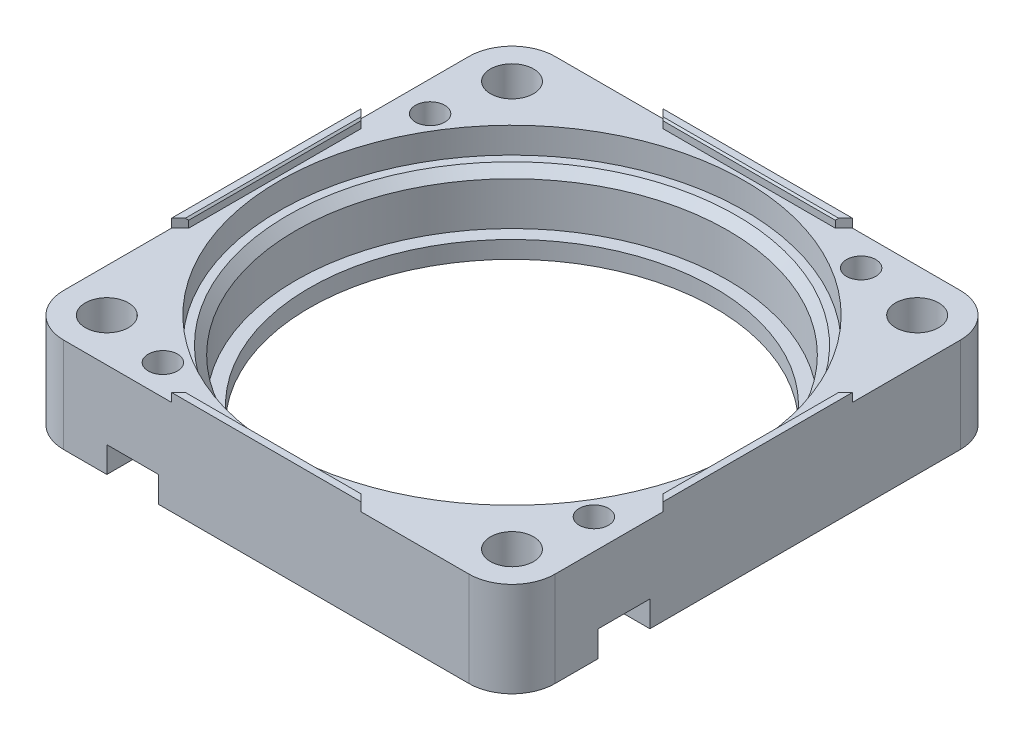
from build123d import *

# Parameters (mm, degrees)
SKETCH_1_W                           = 57
SKETCH_1_H                           = 57
EXTRUDE_1_DEPTH                      = 11
FILLET_1_R                           = 5
SKETCH_2_R                           = 27
CUT_EXTRUDE_1_DEPTH                  = 3
SKETCH_3_R                           = 25.05
CUT_EXTRUDE_2_DEPTH                  = 6
SKETCH_4_R                           = 23.5
CUT_EXTRUDE_3_DEPTH                  = 2
CHAMFER_1_SIZE                       = 1
SKETCH_5_R                           = 2.5
SKETCH_5_R_2                         = 1.7
CUT_EXTRUDE_4_DEPTH                  = 42.779181419
EXTRUDE_2_DEPTH                      = 1
CHAMFER_2_SIZE                       = 0.2
CUT_EXTRUDE_5_DEPTH                  = 3
PATTERN_CIRCULAR_1_COUNT             = 4
CHAMFER_2_OF_PATTERN_CIRCULAR_1_SIZE = 0.2


with BuildPart() as part:
    # 草图1 → 凸台-拉伸1 (new body)
    with BuildSketch(Plane(origin=(0, 0, 0), x_dir=(1, 0, 0), z_dir=(0, 1, 0))):
        Rectangle(SKETCH_1_W, SKETCH_1_H)
    extrude(amount=EXTRUDE_1_DEPTH)

    # 圆角1
    fillet_1_edges = [part.edges().sort_by_distance(p)[0] for p in [
        (28.5, 5.5, 28.5),
        (-28.5, 5.5, 28.5),
        (-28.5, 5.5, -28.5),
        (28.5, 5.5, -28.5),
    ]]
    fillet(fillet_1_edges, radius=FILLET_1_R)

    # 草图2 → 切除-拉伸1 (cut)
    with BuildSketch(Plane(origin=(0, 11, 0), x_dir=(1, 0, 0), z_dir=(0, 1, 0))):
        with Locations(Location((0, 0, 0), (0, 0, 270))):
            Circle(SKETCH_2_R)
    extrude(amount=-CUT_EXTRUDE_1_DEPTH, mode=Mode.SUBTRACT)

    # 草图3 → 切除-拉伸2 (cut)
    with BuildSketch(Plane(origin=(0, 8, 0), x_dir=(1, 0, 0), z_dir=(0, 1, 0))):
        with Locations(Location((0, 0, 0), (0, 0, 270))):
            Circle(SKETCH_3_R)
    extrude(amount=-CUT_EXTRUDE_2_DEPTH, mode=Mode.SUBTRACT)

    # 草图4 → 切除-拉伸3 (cut)
    with BuildSketch(Plane(origin=(0, 2, 0), x_dir=(1, 0, 0), z_dir=(0, 1, 0))):
        with Locations(Location((0, 0, 0), (0, 0, 270))):
            Circle(SKETCH_4_R)
    extrude(amount=-CUT_EXTRUDE_3_DEPTH, mode=Mode.SUBTRACT)

    # 倒角1
    chamfer_1_edges = [part.edges().sort_by_distance(p)[0] for p in [
        (0, 8, -25.05),
    ]]
    chamfer(chamfer_1_edges, length=CHAMFER_1_SIZE)

    # 草图5 → 切除-拉伸4 (cut, through all)
    with BuildSketch(Plane(origin=(0, 11, 0), x_dir=(1, 0, 0), z_dir=(0, 1, 0))):
        with Locations(Location((-23.5, 23.5, 0), (0, 0, 270))):
            Circle(SKETCH_5_R)
        with Locations(Location((-25, 15.5, 0), (0, 0, 270))):
            Circle(SKETCH_5_R_2)
    cut_extrude_4 = extrude(amount=-CUT_EXTRUDE_4_DEPTH, mode=Mode.SUBTRACT)

    # 草图6 → 凸台-拉伸2 (add)
    with BuildSketch(Plane(origin=(0, 11, 0), x_dir=(1, 0, 0), z_dir=(0, 1, 0))):
        Polygon((-28.5, 11), (-28.5, -11), (-27.5, -10), (-27.5, 10), align=None)
    extrude_2 = extrude(amount=EXTRUDE_2_DEPTH)

    # 倒角2
    chamfer_2_edges = [part.edges().sort_by_distance(p)[0] for p in [
        (-27.5, 12, 0),
    ]]
    chamfer(chamfer_2_edges, length=CHAMFER_2_SIZE)

    # 草图7 → 切除-拉伸5 (cut)
    with BuildSketch(Plane.XZ):
        with BuildLine():
            Line((-25, -18.5), (-30.818208661, -18.5))
            ThreePointArc((-30.818208661, -18.5), (-33.818208661, -15.5), (-30.818208661, -12.5))
            Line((-30.818208661, -12.5), (-25, -12.5))
            ThreePointArc((-25, -12.5), (-22, -15.5), (-25, -18.5))
        make_face()
    cut_extrude_5 = extrude(amount=-CUT_EXTRUDE_5_DEPTH, mode=Mode.SUBTRACT)

    # 阵列(圆周)1: 切除-拉伸4, 凸台-拉伸2, 切除-拉伸5 ×4 about axis
    pattern_circular_1_axis = Axis((0, 0, 0), (0, 1, 0))
    add([cut_extrude_4.rotate(pattern_circular_1_axis, i * 360 / PATTERN_CIRCULAR_1_COUNT) for i in range(1, PATTERN_CIRCULAR_1_COUNT)], mode=Mode.SUBTRACT)
    add([extrude_2.rotate(pattern_circular_1_axis, i * 360 / PATTERN_CIRCULAR_1_COUNT) for i in range(1, PATTERN_CIRCULAR_1_COUNT)])
    add([cut_extrude_5.rotate(pattern_circular_1_axis, i * 360 / PATTERN_CIRCULAR_1_COUNT) for i in range(1, PATTERN_CIRCULAR_1_COUNT)], mode=Mode.SUBTRACT)

    # 倒角2 of 阵列(圆周)1
    chamfer_2_of_pattern_circular_1_edges = [part.edges().sort_by_distance(p)[0] for p in [
        (0, 12, 27.5),
        (27.5, 12, 0),
        (0, 12, -27.5),
    ]]
    chamfer(chamfer_2_of_pattern_circular_1_edges, length=CHAMFER_2_OF_PATTERN_CIRCULAR_1_SIZE)


solid = part.part
